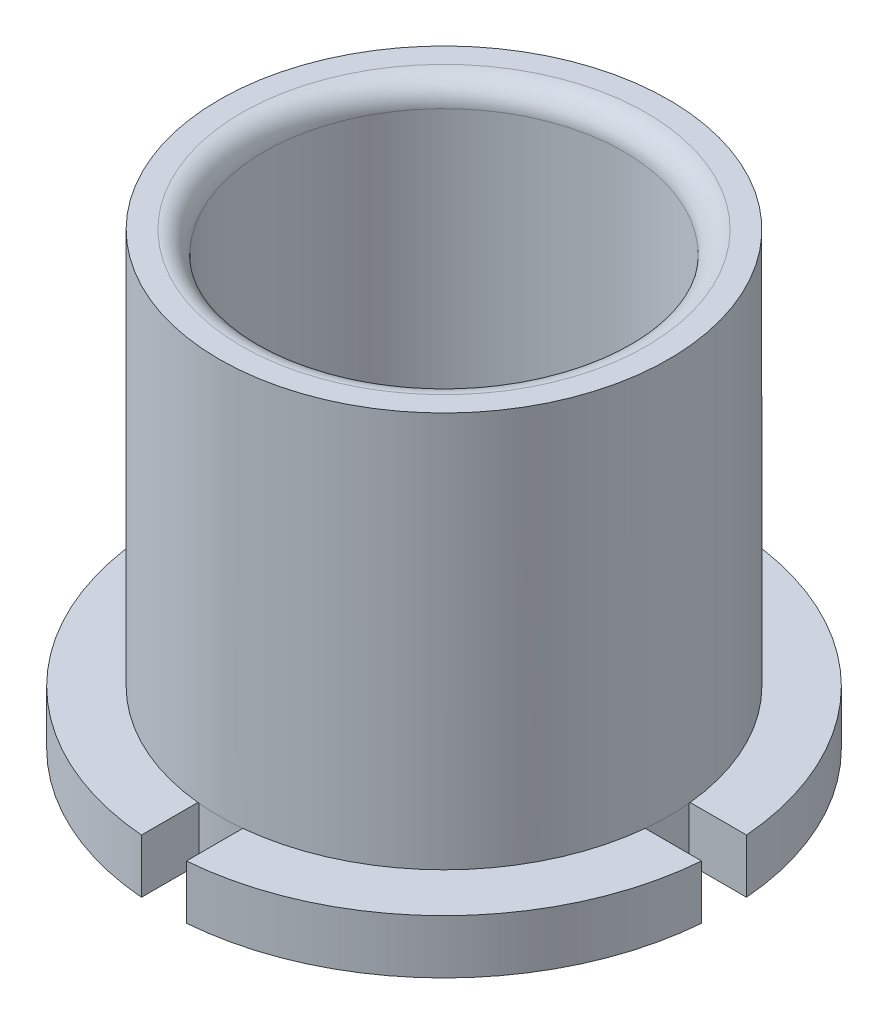
from build123d import *

# Parameters (mm, degrees)
SKETCH1_R           = 12.7
SKETCH1_R_2         = 10.16
BOSS_EXTRUDE1_DEPTH = 25.4
FILLET1_R           = 1.27
SKETCH2_R           = 15.875
SKETCH2_R_2         = 12.7
BOSS_EXTRUDE2_DEPTH = 3.048
CUT_EXTRUDE1_DEPTH  = 3.048


with BuildPart() as part:
    # Sketch1 → Boss-Extrude1 (new body)
    with BuildSketch(Plane(origin=(0, 0, 0), x_dir=(1, 0, 0), z_dir=(0, 1, 0))):
        with Locations(Location((0, 0, 0), (0, 0, 270))):
            Circle(SKETCH1_R)
        with Locations(Location((0, 0, 0), (0, 0, 270))):
            Circle(SKETCH1_R_2, mode=Mode.SUBTRACT)
    extrude(amount=BOSS_EXTRUDE1_DEPTH)

    # Fillet1
    fillet1_edges = [part.edges().sort_by_distance(p)[0] for p in [
        (0, 25.4, -10.16),
    ]]
    fillet(fillet1_edges, radius=FILLET1_R)

    # Sketch2 → Boss-Extrude2 (add)
    with BuildSketch(Plane.XZ):
        with Locations(Location((0, 0, 0), (0, 0, 270))):
            Circle(SKETCH2_R)
        with Locations(Location((0, 0, 0), (0, 0, 270))):
            Circle(SKETCH2_R_2, mode=Mode.SUBTRACT)
    extrude(amount=-BOSS_EXTRUDE2_DEPTH)

    # Sketch3 → Cut-Extrude1 (cut)
    with BuildSketch(Plane(origin=(0, 3.048, 0), x_dir=(1, 0, 0), z_dir=(0, 1, 0))):
        with BuildLine():
            Line((-1.27, 16.390053577), (-1.27, 12.580053577))
            ThreePointArc((-1.27, 12.580053577), (0, 12.64399652), (1.27, 12.580053577))
            Line((1.27, 12.580053577), (1.27, 16.390053577))
            Line((1.27, 16.390053577), (-1.27, 16.390053577))
        make_face()
        with BuildLine():
            Line((12.580053577, -1.27), (16.390053577, -1.27))
            Line((16.390053577, -1.27), (16.390053577, 1.27))
            Line((16.390053577, 1.27), (12.580053577, 1.27))
            ThreePointArc((12.580053577, 1.27), (12.64399652, 0), (12.580053577, -1.27))
        make_face()
        with BuildLine():
            Line((-1.27, -12.580053577), (-1.27, -16.390053577))
            Line((-1.27, -16.390053577), (1.27, -16.390053577))
            Line((1.27, -16.390053577), (1.27, -12.580053577))
            ThreePointArc((1.27, -12.580053577), (0, -12.64399652), (-1.27, -12.580053577))
        make_face()
        with BuildLine():
            Line((-12.580053577, 1.27), (-16.390053577, 1.27))
            Line((-16.390053577, 1.27), (-16.390053577, -1.27))
            Line((-16.390053577, -1.27), (-12.580053577, -1.27))
            ThreePointArc((-12.580053577, -1.27), (-12.64399652, 0), (-12.580053577, 1.27))
        make_face()
    extrude(amount=-CUT_EXTRUDE1_DEPTH, mode=Mode.SUBTRACT)


solid = part.part
